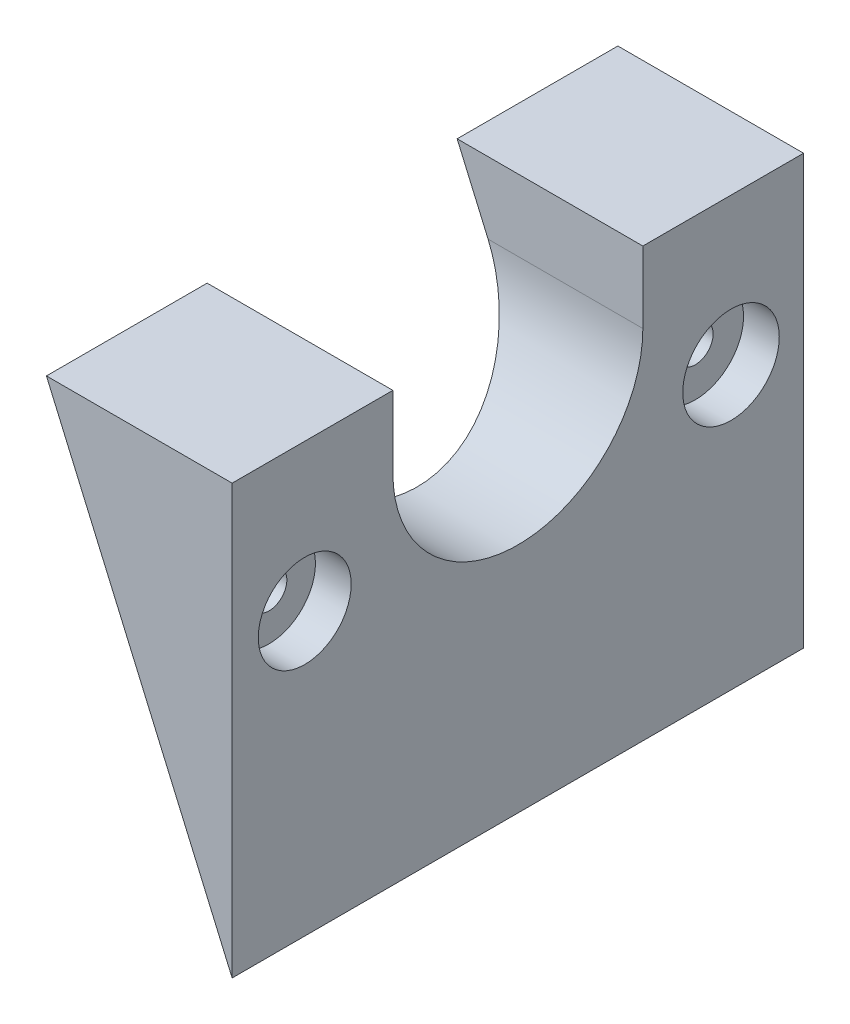
from build123d import *

# Parameters (mm, degrees)
BOSS_EXTRU_1_DEPTH      = 80
ENL_V_MAT_EXTRU_1_DEPTH = 104.324730825
ESQUISSE4_R             = 2.5
ENL_V_MAT_EXTRU_2_DEPTH = 80
ESQUISSE6_R             = 6.505119939
ESQUISSE6_R_2           = 6.755806102
ENL_V_MAT_EXTRU_3_DEPTH = 5


with BuildPart() as part:
    # Esquisse2 → Boss.-Extru.1 (new body)
    with BuildSketch(Plane.XY):
        Polygon((0, 0), (0, 60), (-26, 60), align=None)
    extrude(amount=BOSS_EXTRU_1_DEPTH)

    # Esquisse3 → Enlèv. mat.-Extru.1 (cut, through all)
    with BuildSketch(Plane(origin=(0, 0, 0), x_dir=(0, 0, -1), z_dir=(1, 0, 0))):
        with BuildLine():
            Line((-57.5, 50), (-57.5, 60))
            Line((-57.5, 60), (-22.5, 60))
            Line((-22.5, 60), (-22.5, 50))
            ThreePointArc((-22.5, 50), (-40, 32.5), (-57.5, 50))
        make_face()
    extrude(amount=-ENL_V_MAT_EXTRU_1_DEPTH, mode=Mode.SUBTRACT)

    # Esquisse4 → Enlèv. mat.-Extru.2 (cut)
    with BuildSketch(Plane(origin=(0, 0, 0), x_dir=(0, 0, -1), z_dir=(1, 0, 0))):
        with Locations((-69.841791115, 39.429492972)):
            Circle(ESQUISSE4_R)
        with Locations((-10.158208885, 39.429492972)):
            Circle(ESQUISSE4_R)
    extrude(amount=-ENL_V_MAT_EXTRU_2_DEPTH, mode=Mode.SUBTRACT)

    # Esquisse6 → Enlèv. mat.-Extru.3 (cut)
    with BuildSketch(Plane(origin=(0, 0, 0), x_dir=(0, 0, -1), z_dir=(1, 0, 0))):
        with Locations((-69.841791115, 39.429492972)):
            Circle(ESQUISSE6_R)
        with Locations((-10.158208885, 39.429492972)):
            Circle(ESQUISSE6_R_2)
    extrude(amount=-ENL_V_MAT_EXTRU_3_DEPTH, mode=Mode.SUBTRACT)


solid = part.part
